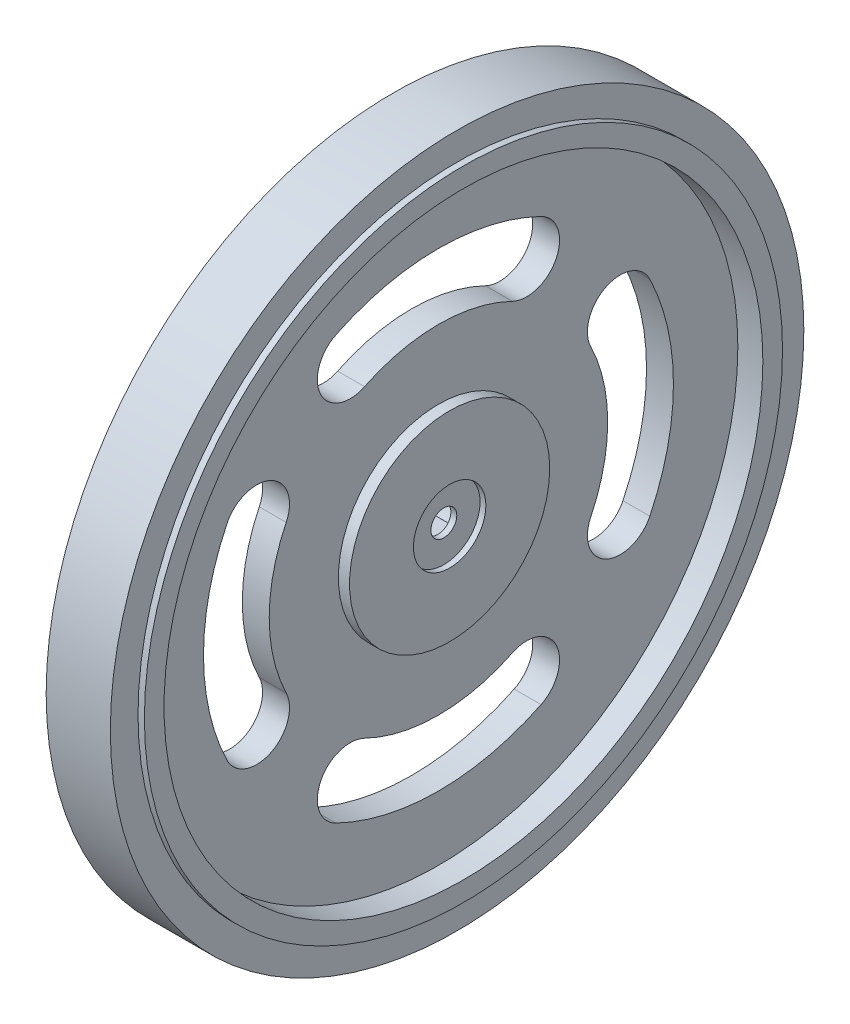
from build123d import *

# Parameters (mm, degrees)
CUT_EXTRUDE1_REACH  = 49.661
BOSS_EXTRUDE1_DEPTH = 5.15


with BuildPart() as part:
    # Sketch2 → Revolve1 (revolve)
    with BuildSketch(Plane.XY, mode=Mode.PRIVATE) as revolve1_sk:
        Polygon((2.38, 3.5), (2.38, 9.67), (1.3, 9.67), (1.3, 28.925), (3.715, 28.925), (3.715, 30.825), (3.1, 30.825), (3.1, 33.5), (-3.1, 33.5), (-3.1, 30.825), (-3.715, 30.825), (-3.715, 28.925), (-1.3, 28.925), (-1.3, 4.975), (-3.9, 4.5), (-3.9, 3.5), (1.25, 3.5), (1.25, 1.25), (1.82, 1.25), (1.82, 3.5), align=None)
    revolve(revolve1_sk.sketch.rotate(Axis((15.916528922, 0, 0), (-1, 0, 0)), 90), axis=Axis((15.916528922, 0, 0), (-1, 0, 0)))

    # Sketch3 → Cut-Extrude1 (cut, up to next)
    with BuildSketch(Plane(origin=(1.3, 0, 0), x_dir=(0, 0, -1), z_dir=(1, 0, 0)), mode=Mode.PRIVATE) as cut_extrude1_sk1:
        with BuildLine():
            ThreePointArc((9.911267606, 20.421967938), (0, 22.7), (-9.911267606, 20.421967938))
            ThreePointArc((-9.911267606, 20.421967938), (-11.381376573, 16.179323759), (-7.138732394, 14.709214792))
            ThreePointArc((-7.138732394, 14.709214792), (0, 16.35), (7.138732394, 14.709214792))
            ThreePointArc((7.138732394, 14.709214792), (11.381376573, 16.179323759), (9.911267606, 20.421967938))
        make_face()
    cut_extrude1_tool1 = extrude(cut_extrude1_sk1.sketch, amount=-CUT_EXTRUDE1_REACH, mode=Mode.PRIVATE) & part.part
    # Sketch3 → Cut-Extrude1 (cut, up to next)
    with BuildSketch(Plane(origin=(1.3, 0, 0), x_dir=(0, 0, -1), z_dir=(1, 0, 0)), mode=Mode.PRIVATE) as cut_extrude1_sk2:
        with BuildLine():
            ThreePointArc((20.421967938, -9.911267606), (22.7, 0), (20.421967938, 9.911267606))
            ThreePointArc((20.421967938, 9.911267606), (16.179323759, 11.381376573), (14.709214792, 7.138732394))
            ThreePointArc((14.709214792, 7.138732394), (16.35, 0), (14.709214792, -7.138732394))
            ThreePointArc((14.709214792, -7.138732394), (16.179323759, -11.381376573), (20.421967938, -9.911267606))
        make_face()
    cut_extrude1_tool2 = extrude(cut_extrude1_sk2.sketch, amount=-CUT_EXTRUDE1_REACH, mode=Mode.PRIVATE) & part.part
    # Sketch3 → Cut-Extrude1 (cut, up to next)
    with BuildSketch(Plane(origin=(1.3, 0, 0), x_dir=(0, 0, -1), z_dir=(1, 0, 0)), mode=Mode.PRIVATE) as cut_extrude1_sk3:
        with BuildLine():
            ThreePointArc((-9.911267606, -20.421967938), (0, -22.7), (9.911267606, -20.421967938))
            ThreePointArc((9.911267606, -20.421967938), (11.381376573, -16.179323759), (7.138732394, -14.709214792))
            ThreePointArc((7.138732394, -14.709214792), (0, -16.35), (-7.138732394, -14.709214792))
            ThreePointArc((-7.138732394, -14.709214792), (-11.381376573, -16.179323759), (-9.911267606, -20.421967938))
        make_face()
    cut_extrude1_tool3 = extrude(cut_extrude1_sk3.sketch, amount=-CUT_EXTRUDE1_REACH, mode=Mode.PRIVATE) & part.part
    # Sketch3 → Cut-Extrude1 (cut, up to next)
    with BuildSketch(Plane(origin=(1.3, 0, 0), x_dir=(0, 0, -1), z_dir=(1, 0, 0)), mode=Mode.PRIVATE) as cut_extrude1_sk4:
        with BuildLine():
            ThreePointArc((-20.421967938, 9.911267606), (-22.7, 0), (-20.421967938, -9.911267606))
            ThreePointArc((-20.421967938, -9.911267606), (-16.179323759, -11.381376573), (-14.709214792, -7.138732394))
            ThreePointArc((-14.709214792, -7.138732394), (-16.35, 0), (-14.709214792, 7.138732394))
            ThreePointArc((-14.709214792, 7.138732394), (-16.179323759, 11.381376573), (-20.421967938, 9.911267606))
        make_face()
    cut_extrude1_tool4 = extrude(cut_extrude1_sk4.sketch, amount=-CUT_EXTRUDE1_REACH, mode=Mode.PRIVATE) & part.part
    add(cut_extrude1_tool1.solids().sort_by_distance((1.3, 18.580512, 0))[0], mode=Mode.SUBTRACT)
    add(cut_extrude1_tool2.solids().sort_by_distance((1.3, 0, -18.580512))[0], mode=Mode.SUBTRACT)
    add(cut_extrude1_tool3.solids().sort_by_distance((1.3, -18.580512, 0))[0], mode=Mode.SUBTRACT)
    add(cut_extrude1_tool4.solids().sort_by_distance((1.3, 0, 18.580512))[0], mode=Mode.SUBTRACT)

    # Sketch4 → Boss-Extrude1 (add)
    with BuildSketch(Plane.ZY.offset(-1.25)):
        with BuildLine():
            Line((-2.570870475, 2.375), (2.570870475, 2.375))
            ThreePointArc((2.570870475, 2.375), (0, 3.5), (-2.570870475, 2.375))
        make_face()
        with BuildLine():
            Line((-2.570870475, -2.375), (2.570870475, -2.375))
            ThreePointArc((2.570870475, -2.375), (0, -3.5), (-2.570870475, -2.375))
        make_face()
    extrude(amount=BOSS_EXTRUDE1_DEPTH)


solid = part.part
